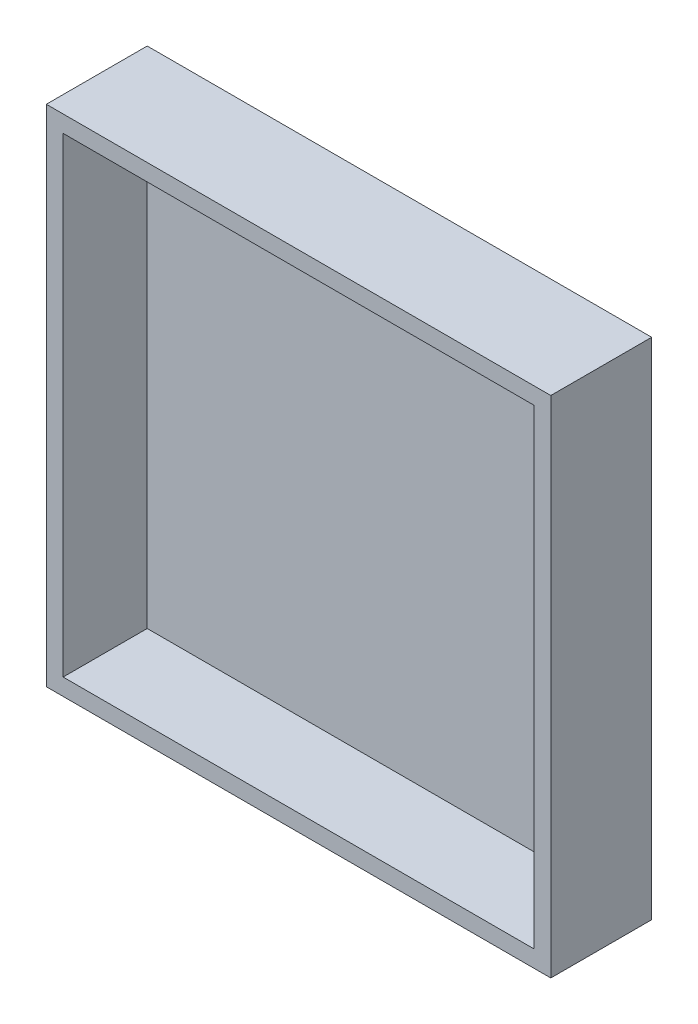
from build123d import *

# Parameters (mm, degrees)
SKETCH1_W           = 150
SKETCH1_H           = 150
BOSS_EXTRUDE1_DEPTH = 30
SHELL1_T            = -5


with BuildPart() as part:
    # Sketch1 → Boss-Extrude1 (new body)
    with BuildSketch(Plane.XY):
        with Locations((-75, 72.241880209)):
            Rectangle(SKETCH1_W, SKETCH1_H)
    extrude(amount=BOSS_EXTRUDE1_DEPTH)

    # Shell1
    shell1_openings = [part.faces().sort_by_distance(p)[0] for p in [
        (-75, 72.241880209, 30),
    ]]
    offset(amount=SHELL1_T, openings=shell1_openings, kind=Kind.INTERSECTION)


solid = part.part
